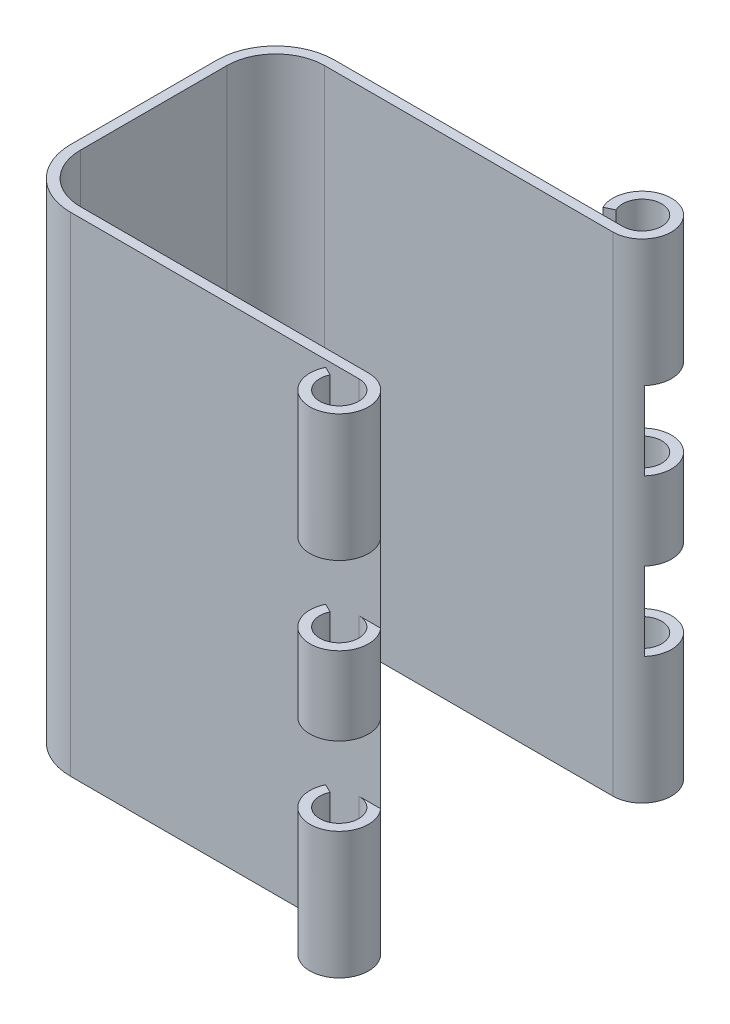
from build123d import *

# Parameters (mm, degrees)
BOSS_EXTRUDE1_DEPTH = 12.7
SKETCH2_W           = 2.488429633
SKETCH2_H           = 2.032
CUT_EXTRUDE1_DEPTH  = 12.7


with BuildPart() as part:
    # Sketch1 → Boss-Extrude1 (new body)
    with BuildSketch(Plane(origin=(0, 0, 0), x_dir=(1, 0, 0), z_dir=(0, 1, 0))):
        with BuildLine():
            ThreePointArc((8.763, -3.175), (9.167603241, -4.582709081), (8.077288748, -3.60466872))
            Line((8.077288748, -3.60466872), (8.305859166, -3.715445814))
            ThreePointArc((8.305859166, -3.715445814), (9.032735494, -4.367472721), (8.763, -3.429))
            Line((8.763, -3.429), (1.27, -3.429))
            ThreePointArc((1.27, -3.429), (0.192369265, -2.982630735), (-0.254, -1.905))
            Line((-0.254, -1.905), (-0.254, 1.905))
            ThreePointArc((-0.254, 1.905), (0.192369265, 2.982630735), (1.27, 3.429))
            Line((1.27, 3.429), (8.763, 3.429))
            ThreePointArc((8.763, 3.429), (9.032735494, 4.367472721), (8.305859166, 3.715445814))
            Line((8.305859166, 3.715445814), (8.077288748, 3.60466872))
            ThreePointArc((8.077288748, 3.60466872), (9.167603241, 4.582709081), (8.763, 3.175))
            Line((8.763, 3.175), (1.27, 3.175))
            ThreePointArc((1.27, 3.175), (0.371974388, 2.803025612), (0, 1.905))
            Line((0, 1.905), (0, -1.905))
            ThreePointArc((0, -1.905), (0.371974388, -2.803025612), (1.27, -3.175))
            Line((1.27, -3.175), (8.763, -3.175))
        make_face()
    extrude(amount=BOSS_EXTRUDE1_DEPTH)

    # Sketch2 → Cut-Extrude1 (cut)
    with BuildSketch(Plane.ZY.offset(0.254)):
        with Locations((-4.673214816, 8.382)):
            Rectangle(SKETCH2_W, SKETCH2_H)
        with Locations((-4.673214816, 4.318)):
            Rectangle(SKETCH2_W, SKETCH2_H)
    cut_extrude1 = extrude(amount=-CUT_EXTRUDE1_DEPTH, mode=Mode.SUBTRACT)

    # Mirror1: Cut-Extrude1 across plane
    add(cut_extrude1.mirror(Plane(origin=(0, 0, 0), x_dir=(1, 0, 0), z_dir=(0, 0, -1))), mode=Mode.SUBTRACT)


solid = part.part
